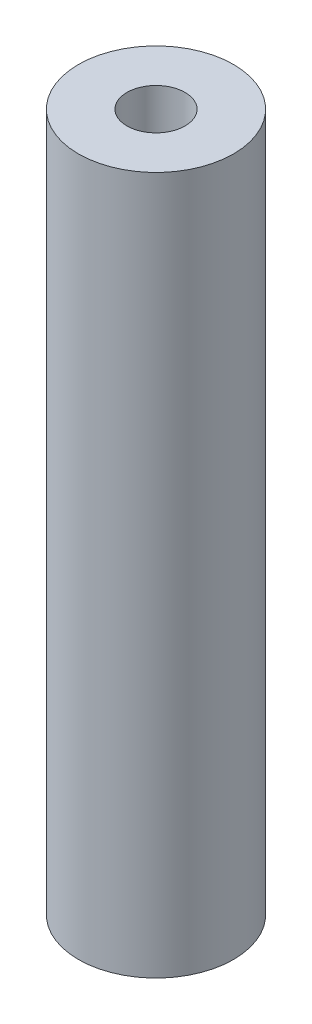
from build123d import *

# Parameters (mm, degrees)
SKETCH_1_R      = 2
SKETCH_1_R_2    = 0.75
EXTRUDE_1_DEPTH = 18


with BuildPart() as part:
    # 草图1 → 凸台-拉伸1 (new body)
    with BuildSketch(Plane(origin=(0, 0, 0), x_dir=(1, 0, 0), z_dir=(0, 1, 0))):
        Circle(SKETCH_1_R)
        Circle(SKETCH_1_R_2, mode=Mode.SUBTRACT)
    extrude(amount=EXTRUDE_1_DEPTH)


solid = part.part
